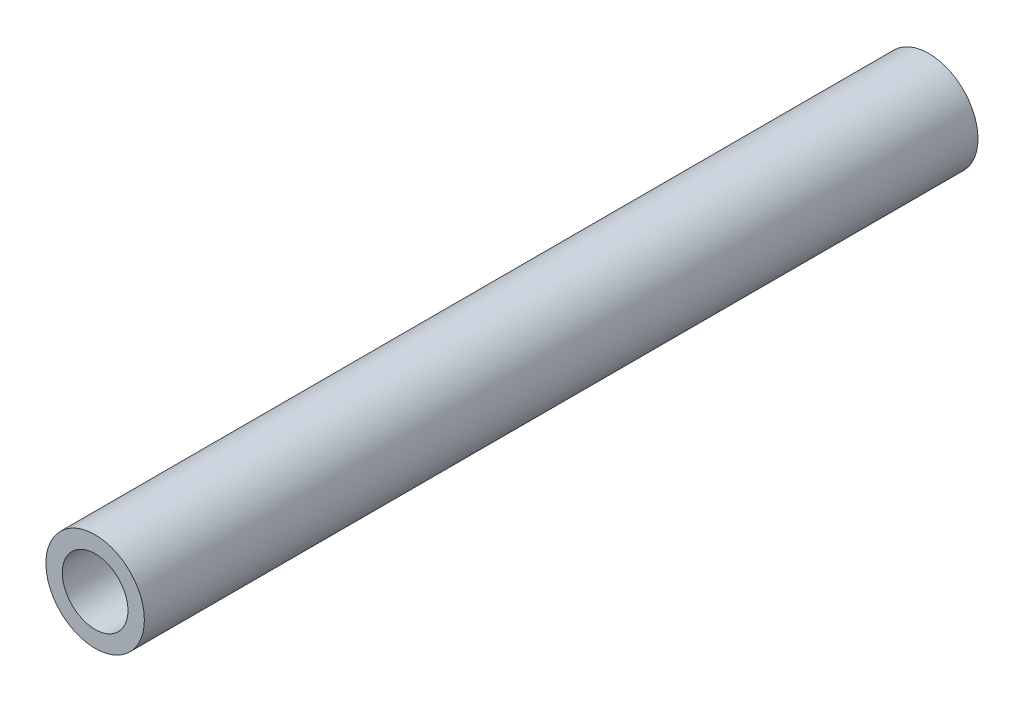
from build123d import *

# Parameters (mm, degrees)
SKETCH1_R           = 3
SKETCH1_R_2         = 2
BOSS_EXTRUDE1_DEPTH = 50.8


with BuildPart() as part:
    # Sketch1 → Boss-Extrude1 (new body)
    with BuildSketch(Plane.XY):
        Circle(SKETCH1_R)
        Circle(SKETCH1_R_2, mode=Mode.SUBTRACT)
    extrude(amount=BOSS_EXTRUDE1_DEPTH)


solid = part.part
